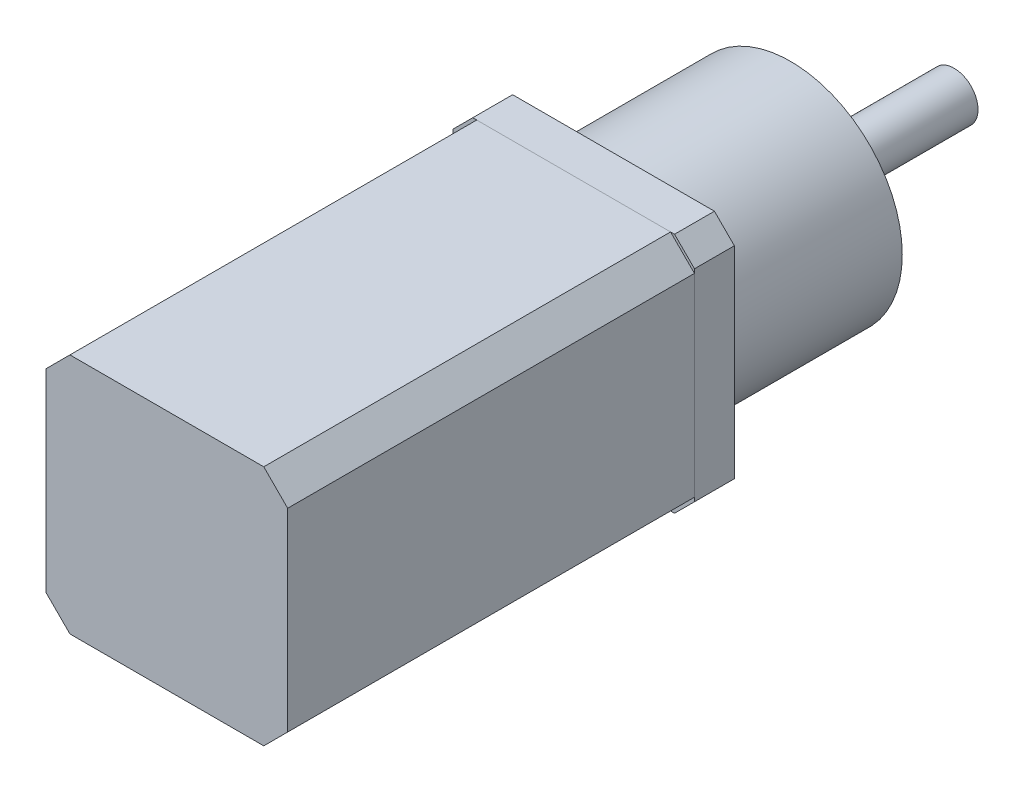
from build123d import *

# Parameters (mm, degrees)
SKETCH1_W           = 30.3
SKETCH1_H           = 30.3
BOSS_EXTRUDE1_DEPTH = 51
SKETCH4_W           = 30.3
SKETCH4_H           = 30.3
BOSS_EXTRUDE4_DEPTH = 5
SKETCH5_R           = 14
BOSS_EXTRUDE5_DEPTH = 22.2
SKETCH6_R           = 9
BOSS_EXTRUDE6_DEPTH = 2
SKETCH7_R           = 3
BOSS_EXTRUDE7_DEPTH = 18.5
SKETCH8_R           = 4.32234312
BOSS_EXTRUDE8_DEPTH = 0.4
CHAMFER1_SIZE       = 3
CHAMFER2_SIZE       = 2.5


with BuildPart() as part:
    # Sketch1 → Boss-Extrude1 (new body)
    with BuildSketch(Plane.XY):
        Rectangle(SKETCH1_W, SKETCH1_H)
    extrude(amount=BOSS_EXTRUDE1_DEPTH)

    # Chamfer1
    chamfer1_edges = [part.edges().sort_by_distance(p)[0] for p in [
        (15.15, -15.15, 25.5),
        (-15.15, -15.15, 25.5),
        (-15.15, 15.15, 25.5),
        (15.15, 15.15, 25.5),
    ]]
    chamfer(chamfer1_edges, length=CHAMFER1_SIZE)


with BuildPart() as body_2:
    # Sketch4 → Boss-Extrude4 (new body)
    with BuildSketch(Plane(origin=(0, 0, 0), x_dir=(-1, 0, 0), z_dir=(0, 0, -1))):
        Rectangle(SKETCH4_W, SKETCH4_H)
    extrude(amount=BOSS_EXTRUDE4_DEPTH)

    # Sketch5 → Boss-Extrude5 (add)
    with BuildSketch(Plane(origin=(0, 0, -5), x_dir=(-1, 0, 0), z_dir=(0, 0, -1))):
        with Locations(Location((0, 0, 0), (0, 0, 180))):
            Circle(SKETCH5_R)
    extrude(amount=BOSS_EXTRUDE5_DEPTH)

    # Sketch6 → Boss-Extrude6 (add)
    with BuildSketch(Plane(origin=(0, 0, -27.2), x_dir=(-1, 0, 0), z_dir=(0, 0, -1))):
        Circle(SKETCH6_R)
    extrude(amount=BOSS_EXTRUDE6_DEPTH)

    # Sketch7 → Boss-Extrude7 (add)
    with BuildSketch(Plane(origin=(0, 0, -29.2), x_dir=(-1, 0, 0), z_dir=(0, 0, -1))):
        Circle(SKETCH7_R)
    extrude(amount=BOSS_EXTRUDE7_DEPTH)

    # Sketch8 → Boss-Extrude8 (add)
    with BuildSketch(Plane(origin=(0, 0, -29.2), x_dir=(-1, 0, 0), z_dir=(0, 0, -1))):
        Circle(SKETCH8_R)
    extrude(amount=BOSS_EXTRUDE8_DEPTH)

    # Chamfer2
    chamfer2_edges = [body_2.edges().sort_by_distance(p)[0] for p in [
        (-15.15, -15.15, -2.5),
        (15.15, -15.15, -2.5),
        (15.15, 15.15, -2.5),
        (-15.15, 15.15, -2.5),
    ]]
    chamfer(chamfer2_edges, length=CHAMFER2_SIZE)


solid = Compound([part.part, body_2.part])
